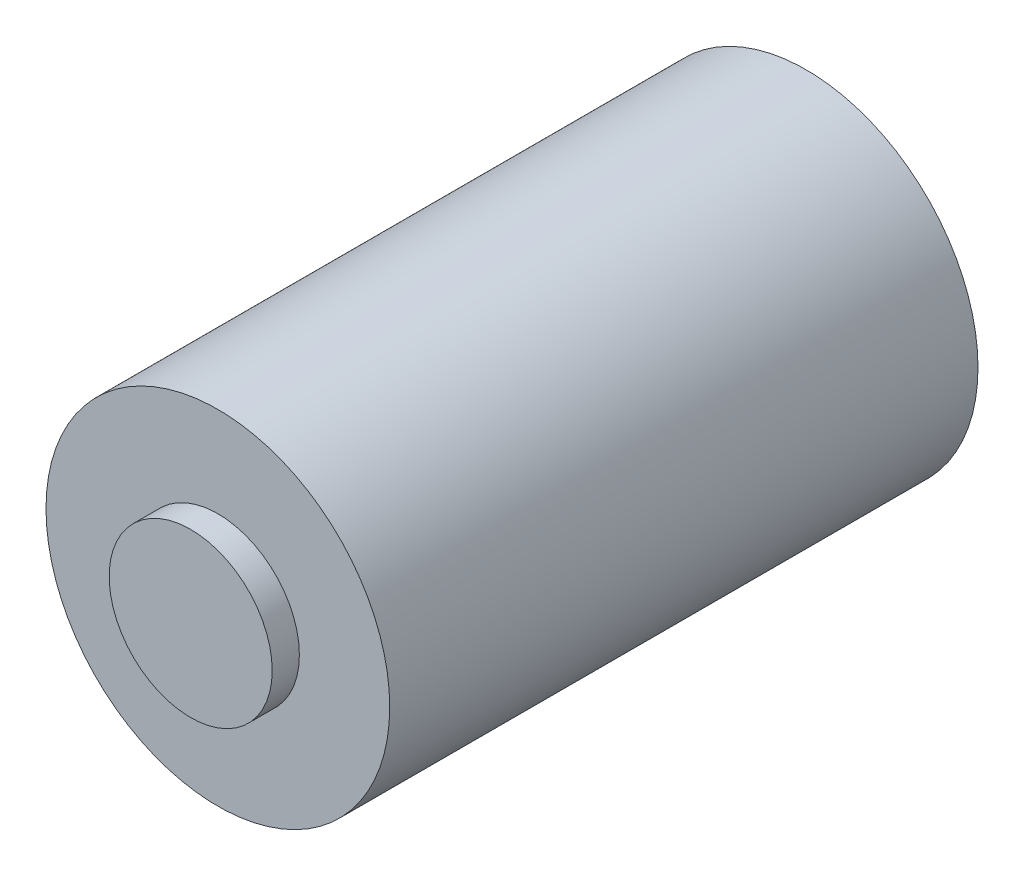
from build123d import *

# Parameters (mm, degrees)
SKETCH1_R           = 32.131
BOSS_EXTRUDE1_DEPTH = 109.982
SKETCH2_R           = 15.24
BOSS_EXTRUDE2_DEPTH = 5.08


with BuildPart() as part:
    # Sketch1 → Boss-Extrude1 (new body)
    with BuildSketch(Plane.XY):
        Circle(SKETCH1_R)
    extrude(amount=BOSS_EXTRUDE1_DEPTH)

    # Sketch2 → Boss-Extrude2 (add)
    with BuildSketch(Plane.XY.offset(109.982)):
        Circle(SKETCH2_R)
    extrude(amount=BOSS_EXTRUDE2_DEPTH)


solid = part.part
